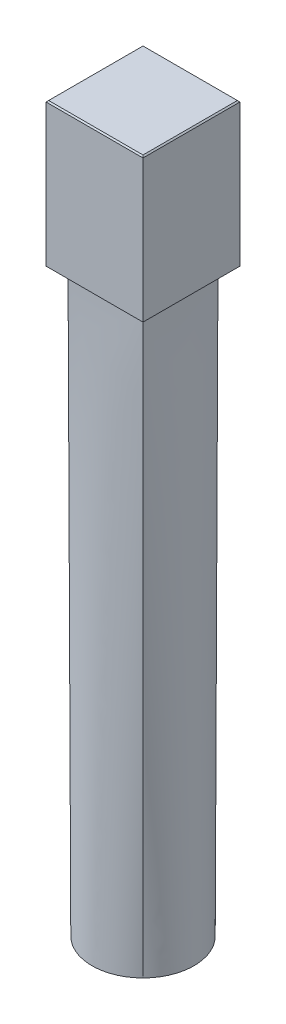
from build123d import *

# Parameters (mm, degrees)
SKETCH3_W           = 3.75
SKETCH3_H           = 3.75
BOSS_EXTRUDE4_DEPTH = 5.6
CHAMFER1_SIZE       = 0.05


with BuildPart() as part:
    # Sketch1 for Loft1 → Loft1 section 0
    with BuildSketch(Plane(origin=(0, 0, 0), x_dir=(1, 0, 0), z_dir=(0, 1, 0))):
        with BuildLine():
            # circular arc as an exact rational Bezier (weights 1, cos(half-angle), 1)
            Bezier((-1.396535893, -1.396535893), (0, -2.793071785), (1.396535893, -1.396535893), weights=[1, 0.707106781, 1])
            Bezier((1.396535893, -1.396535893), (2.793071785, 0), (1.396535893, 1.396535893), weights=[1, 0.707106781, 1])
            Bezier((1.396535893, 1.396535893), (0, 2.793071785), (-1.396535893, 1.396535893), weights=[1, 0.707106781, 1])
            Bezier((-1.396535893, 1.396535893), (-2.793071785, 0), (-1.396535893, -1.396535893), weights=[1, 0.707106781, 1])
        make_face()
    # Sketch2 → Loft1 section 1
    with BuildSketch(Plane(origin=(0, 22.4, 0), x_dir=(1, 0, 0), z_dir=(0, 1, 0))):
        with BuildLine():
            Line((-1.45, -1.45), (1.45, -1.45))
            Line((1.45, -1.45), (1.45, 1.45))
            Line((1.45, 1.45), (-1.45, 1.45))
            Line((-1.45, 1.45), (-1.45, -1.45))
        make_face()
    loft()

    # Sketch3 → Boss-Extrude4 (add)
    with BuildSketch(Plane(origin=(0, 22.4, 0), x_dir=(1, 0, 0), z_dir=(0, 1, 0))):
        Rectangle(SKETCH3_W, SKETCH3_H)
    extrude(amount=BOSS_EXTRUDE4_DEPTH)

    # Chamfer1
    chamfer1_edges = [part.edges().sort_by_distance(p)[0] for p in [
        (1.875, 22.4, 0),
        (0, 22.4, -1.875),
        (-1.875, 22.4, 0),
        (0, 22.4, 1.875),
        (1.875, 28, 0),
        (0, 28, -1.875),
        (-1.875, 28, 0),
        (0, 28, 1.875),
    ]]
    chamfer(chamfer1_edges, length=CHAMFER1_SIZE)


solid = part.part
